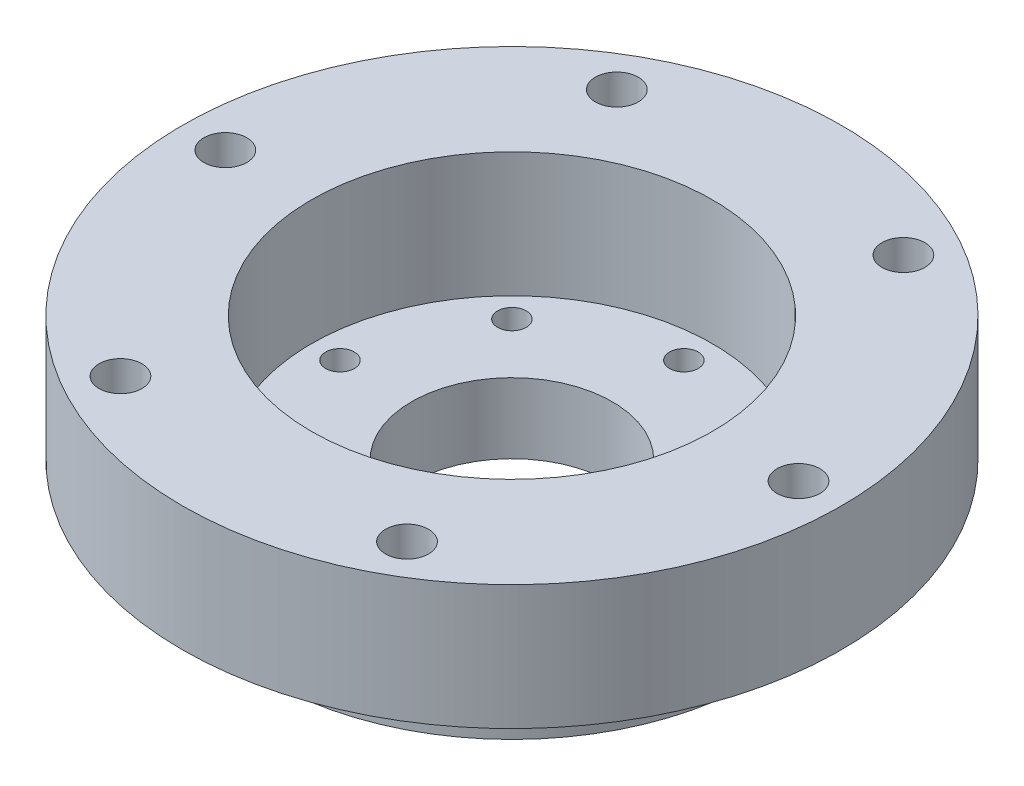
from build123d import *

# Parameters (mm, degrees)
SKETCH_1_R      = 17
SKETCH_1_R_2    = 1
SKETCH_1_R_3    = 7
EXTRUDE_1_DEPTH = 4.9
SKETCH_2_R      = 23
SKETCH_2_R_2    = 1.5
SKETCH_2_R_3    = 17
SKETCH_2_R_4    = 14
EXTRUDE_2_DEPTH = 6
SKETCH_3_R      = 23
SKETCH_3_R_2    = 14
SKETCH_3_R_3    = 1.5
EXTRUDE_3_DEPTH = 2.7


with BuildPart() as part:
    # 草图1 → 凸台-拉伸1 (new body)
    with BuildSketch(Plane(origin=(0, 0, 0), x_dir=(1, 0, 0), z_dir=(0, 1, 0))):
        with Locations(Location((0, 0, 0), (0, 0, 270))):
            Circle(SKETCH_1_R)
        with Locations(Location((8.485281374, -8.485281374, 0), (0, 0, 270))):
            Circle(SKETCH_1_R_2, mode=Mode.SUBTRACT)
        with Locations(Location((8.485281374, 8.485281374, 0), (0, 0, 270))):
            Circle(SKETCH_1_R_2, mode=Mode.SUBTRACT)
        with Locations(Location((0, -12, 0), (0, 0, 270))):
            Circle(SKETCH_1_R_2, mode=Mode.SUBTRACT)
        with Locations(Location((12, 0, 0), (0, 0, 270))):
            Circle(SKETCH_1_R_2, mode=Mode.SUBTRACT)
        with Locations(Location((0, 12, 0), (0, 0, 270))):
            Circle(SKETCH_1_R_2, mode=Mode.SUBTRACT)
        with Locations(Location((0, 0, 0), (0, 0, 270))):
            Circle(SKETCH_1_R_3, mode=Mode.SUBTRACT)
        with Locations(Location((-12, 0, 0), (0, 0, 270))):
            Circle(SKETCH_1_R_2, mode=Mode.SUBTRACT)
        with Locations(Location((-8.485281374, -8.485281374, 0), (0, 0, 270))):
            Circle(SKETCH_1_R_2, mode=Mode.SUBTRACT)
        with Locations(Location((-8.485281374, 8.485281374, 0), (0, 0, 270))):
            Circle(SKETCH_1_R_2, mode=Mode.SUBTRACT)
    extrude(amount=EXTRUDE_1_DEPTH)

    # 草图2 → 凸台-拉伸2 (add)
    # profile 1 of 2: a face of its own
    with BuildSketch(Plane(origin=(0, 4.9, 0), x_dir=(1, 0, 0), z_dir=(0, 1, 0))):
        with Locations(Location((0, 0, 0), (0, 0, 270))):
            Circle(SKETCH_2_R)
        with Locations(Location((-10, -17.320508076, 0), (0, 0, 270))):
            Circle(SKETCH_2_R_2, mode=Mode.SUBTRACT)
        with Locations(Location((-10, 17.320508076, 0), (0, 0, 270))):
            Circle(SKETCH_2_R_2, mode=Mode.SUBTRACT)
        with Locations(Location((10, 17.320508076, 0), (0, 0, 270))):
            Circle(SKETCH_2_R_2, mode=Mode.SUBTRACT)
        with Locations(Location((20, 0, 0), (0, 0, 270))):
            Circle(SKETCH_2_R_2, mode=Mode.SUBTRACT)
        with Locations(Location((-20, 0, 0), (0, 0, 270))):
            Circle(SKETCH_2_R_2, mode=Mode.SUBTRACT)
        with Locations(Location((10, -17.320508076, 0), (0, 0, 270))):
            Circle(SKETCH_2_R_2, mode=Mode.SUBTRACT)
        with Locations(Location((0, 0, 0), (0, 0, 270))):
            Circle(SKETCH_2_R_3, mode=Mode.SUBTRACT)
    # profile 2 of 2: a face of its own
    with BuildSketch(Plane(origin=(0, 4.9, 0), x_dir=(1, 0, 0), z_dir=(0, 1, 0))):
        with Locations(Location((0, 0, 0), (0, 0, 270))):
            Circle(SKETCH_2_R_3)
        with Locations(Location((0, 0, 0), (0, 0, 270))):
            Circle(SKETCH_2_R_4, mode=Mode.SUBTRACT)
    extrude(amount=EXTRUDE_2_DEPTH)

    # 草图3 → 凸台-拉伸3 (add)
    with BuildSketch(Plane(origin=(0, 10.9, 0), x_dir=(1, 0, 0), z_dir=(0, 1, 0))):
        with Locations(Location((0, 0, 0), (0, 0, 270))):
            Circle(SKETCH_3_R)
        with Locations(Location((0, 0, 0), (0, 0, 270))):
            Circle(SKETCH_3_R_2, mode=Mode.SUBTRACT)
        with Locations(Location((10, -17.320508076, 0), (0, 0, 270))):
            Circle(SKETCH_3_R_3, mode=Mode.SUBTRACT)
        with Locations(Location((20, 0, 0), (0, 0, 270))):
            Circle(SKETCH_3_R_3, mode=Mode.SUBTRACT)
        with Locations(Location((10, 17.320508076, 0), (0, 0, 270))):
            Circle(SKETCH_3_R_3, mode=Mode.SUBTRACT)
        with Locations(Location((-10, -17.320508076, 0), (0, 0, 270))):
            Circle(SKETCH_3_R_3, mode=Mode.SUBTRACT)
        with Locations(Location((-20, 0, 0), (0, 0, 270))):
            Circle(SKETCH_3_R_3, mode=Mode.SUBTRACT)
        with Locations(Location((-10, 17.320508076, 0), (0, 0, 270))):
            Circle(SKETCH_3_R_3, mode=Mode.SUBTRACT)
    extrude(amount=EXTRUDE_3_DEPTH)


solid = part.part
